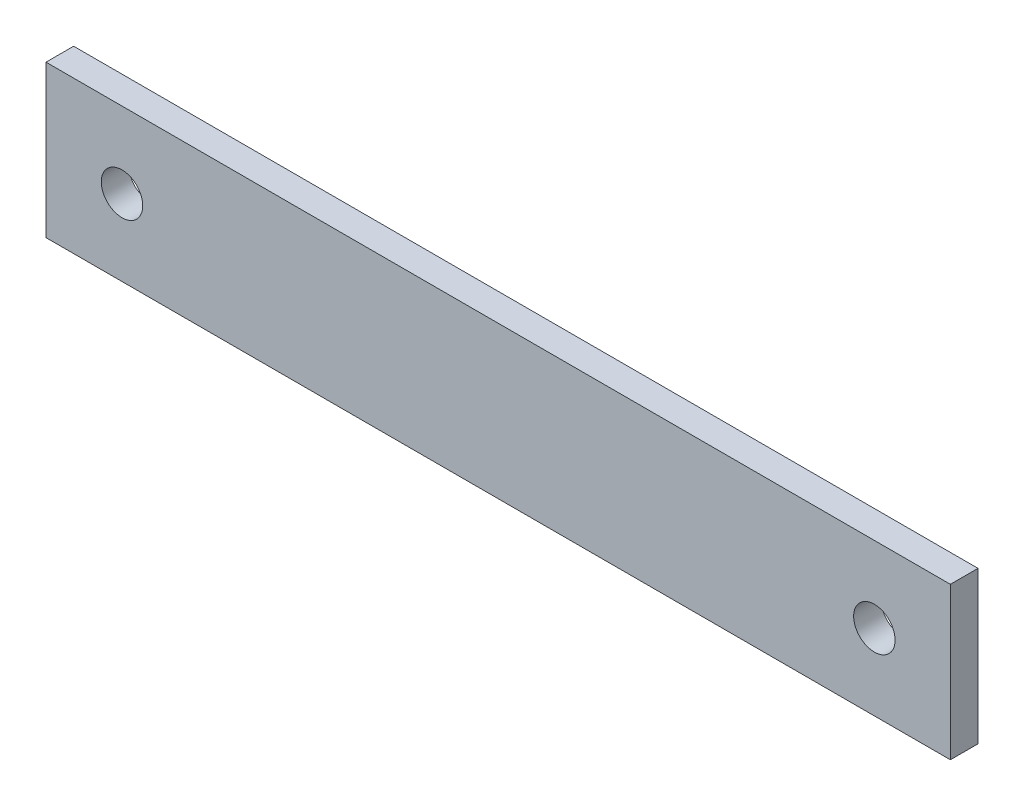
from build123d import *

# Parameters (mm, degrees)
SKETCH_1_W      = 130.9
SKETCH_1_H      = 22
SKETCH_1_R      = 3
EXTRUDE_1_DEPTH = 2


with BuildPart() as part:
    # 草图1 → 凸台-拉伸1 (new, symmetric)
    with BuildSketch(Plane.XY):
        with Locations((54.45, 0)):
            Rectangle(SKETCH_1_W, SKETCH_1_H)
        Circle(SKETCH_1_R, mode=Mode.SUBTRACT)
        with Locations((108.9, 0)):
            Circle(SKETCH_1_R, mode=Mode.SUBTRACT)
    extrude(amount=EXTRUDE_1_DEPTH, both=True)


solid = part.part
